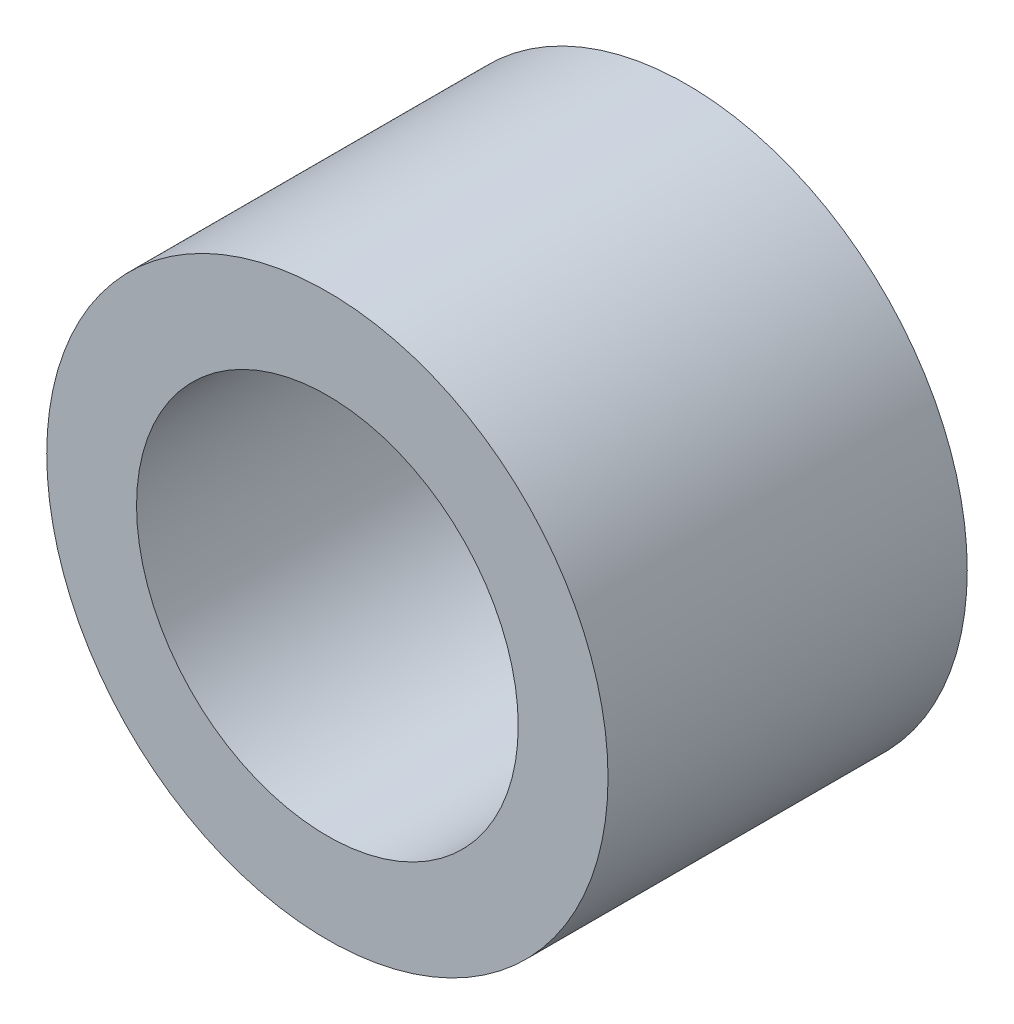
from build123d import *

# Parameters (mm, degrees)
NEEDLE_BEARING_START = 47.5
SKETCH_1_R           = 12.5
SKETCH_1_R_2         = 8.5
NEEDLE_BEARING_DEPTH = 16


with BuildPart() as part:
    # Эскиз1 → Needle_bearing (new body)
    with BuildSketch(Plane.XY.offset(NEEDLE_BEARING_START)):
        Circle(SKETCH_1_R)
        Circle(SKETCH_1_R_2, mode=Mode.SUBTRACT)
    extrude(amount=NEEDLE_BEARING_DEPTH)


solid = part.part
